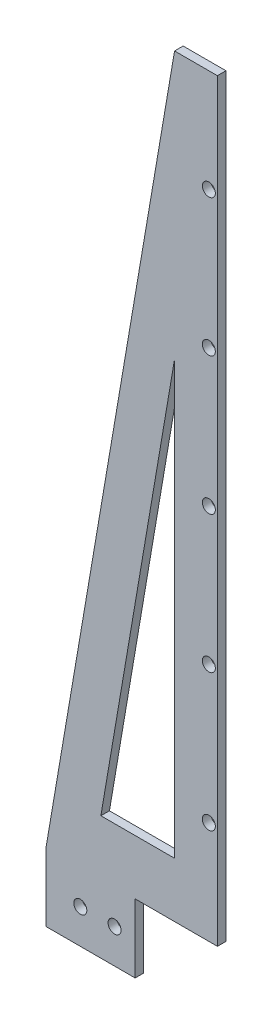
from build123d import *

# Parameters (mm, degrees)
SKETCH1_R           = 2.413
BOSS_EXTRUDE1_DEPTH = 3.175


with BuildPart() as part:
    # Sketch1 → Boss-Extrude1 (new body)
    with BuildSketch(Plane.XY):
        Polygon((0, 0), (33.02, 0), (33.02, 25.4), (63.5, 25.4), (63.5, 304.8), (47.625, 304.8), (0, 25.4), align=None)
        with Locations((12.7, 12.7)):
            Circle(SKETCH1_R, mode=Mode.SUBTRACT)
        with Locations((25.4, 12.7)):
            Circle(SKETCH1_R, mode=Mode.SUBTRACT)
        with Locations((60.325, 63.5)):
            Circle(SKETCH1_R, mode=Mode.SUBTRACT)
        with Locations((60.325, 114.3)):
            Circle(SKETCH1_R, mode=Mode.SUBTRACT)
        with Locations((60.325, 165.1)):
            Circle(SKETCH1_R, mode=Mode.SUBTRACT)
        with Locations((60.325, 215.9)):
            Circle(SKETCH1_R, mode=Mode.SUBTRACT)
        with Locations((60.325, 266.7)):
            Circle(SKETCH1_R, mode=Mode.SUBTRACT)
        Polygon((47.625, 205.909333333), (47.625, 45.72), (20.32, 45.72), align=None, mode=Mode.SUBTRACT)
    extrude(amount=BOSS_EXTRUDE1_DEPTH)


solid = part.part
